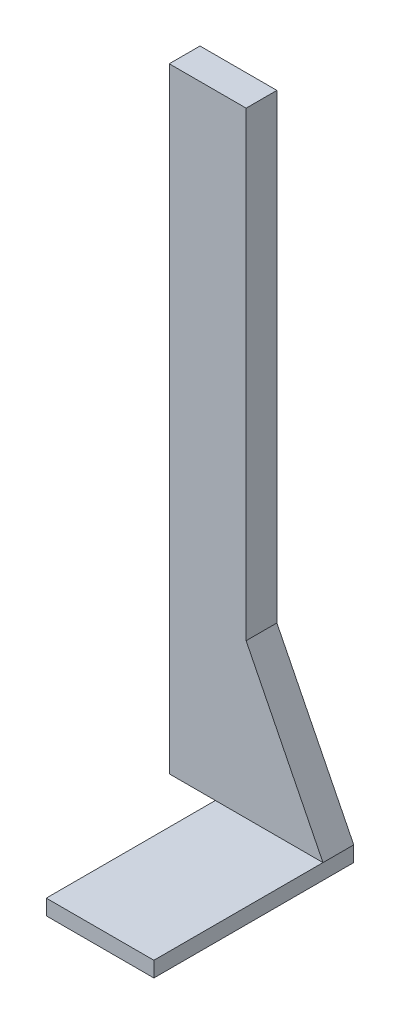
from build123d import *

# Parameters (mm, degrees)
SKETCH1_W           = 35
SKETCH1_H           = 65
BOSS_EXTRUDE1_DEPTH = 5
BOSS_EXTRUDE2_DEPTH = 10


with BuildPart() as part:
    # Sketch1 → Boss-Extrude1 (new body)
    with BuildSketch(Plane(origin=(0, 0, 0), x_dir=(1, 0, 0), z_dir=(0, 1, 0))):
        with Locations((-17.5, -32.5)):
            Rectangle(SKETCH1_W, SKETCH1_H)
    extrude(amount=BOSS_EXTRUDE1_DEPTH)

    # Sketch2 → Boss-Extrude2 (add)
    with BuildSketch(Plane.XY):
        Polygon((0, 5), (-25, 55), (-25, 205), (-50, 205), (-50, 5), align=None)
    extrude(amount=BOSS_EXTRUDE2_DEPTH)


solid = part.part
